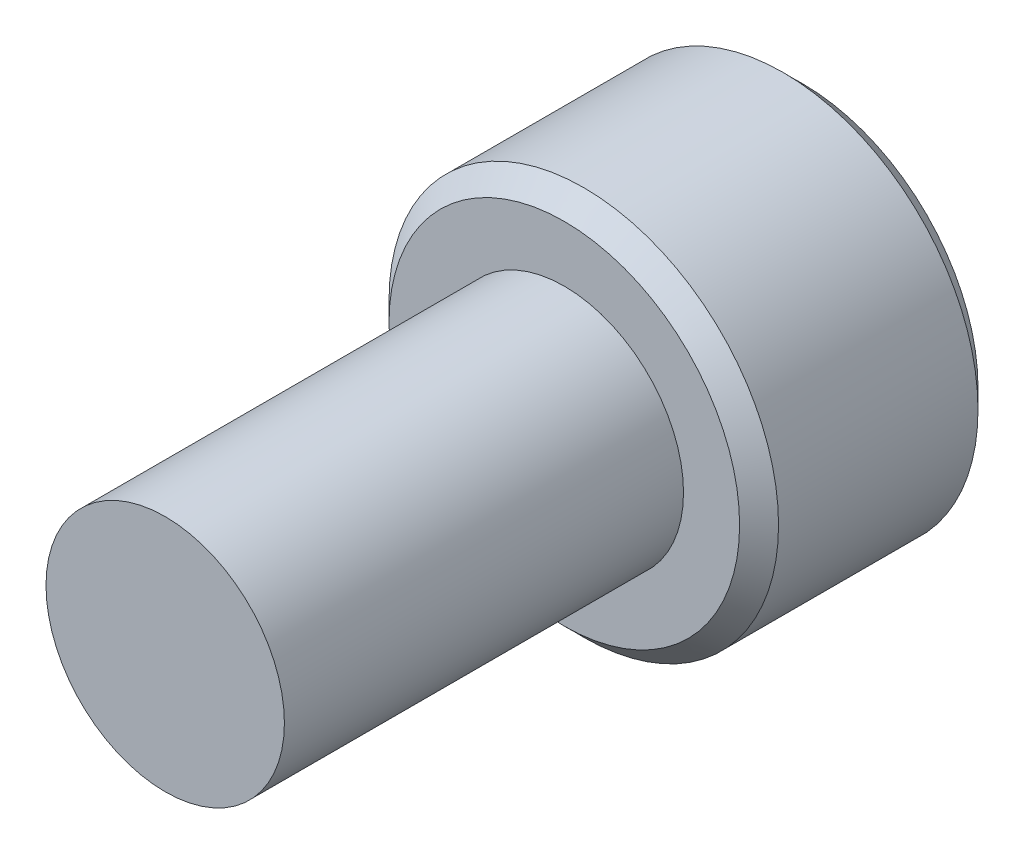
from build123d import *

# Parameters (mm, degrees)
SKETCH1_R          = 1.4224
EXTRUDE1_DEPTH     = 4.7625
SKETCH6_R          = 2.3241
EXTRUDE2_DEPTH     = 2.8448
CUT_EXTRUDE1_DEPTH = 1.7859375
CHAMFER1_SIZE      = 0.23241


with BuildPart() as part:
    # Sketch1 → Extrude1 (new body)
    with BuildSketch(Plane.XY):
        Circle(SKETCH1_R)
    extrude(amount=-EXTRUDE1_DEPTH)

    # Sketch6 → Extrude2 (add)
    with BuildSketch(Plane(origin=(0, 0, -4.7625), x_dir=(-1, 0, 0), z_dir=(0, 0, -1))):
        Circle(SKETCH6_R)
    extrude(amount=EXTRUDE2_DEPTH)

    # Sketch7 → Cut-Extrude1 (cut)
    with BuildSketch(Plane(origin=(0, 0, -7.6073), x_dir=(-1, 0, 0), z_dir=(0, 0, -1))):
        Polygon((0, 1.374815329), (-1.190625, 0.687407664), (-1.190625, -0.687407664), (0, -1.374815329), (1.190625, -0.687407664), (1.190625, 0.687407664), align=None)
    extrude(amount=-CUT_EXTRUDE1_DEPTH, mode=Mode.SUBTRACT)

    # Cut-Extrude2 cone 1 section (through the dimple's axis) → Cut-Extrude2 (revolve, cut)
    with BuildSketch(Plane(origin=(0, 0, -7.6073), x_dir=(0, 1, 0), z_dir=(1, 0, 0))):
        Polygon((0, 0), (1.374815329, 0), (0, 1.374815329), align=None)
    revolve(axis=Axis((0, 0, -7.6073), (0, 0, 1)), mode=Mode.SUBTRACT)

    # Chamfer1
    chamfer1_edges = [part.edges().sort_by_distance(p)[0] for p in [
        (2.3241, 0, -4.7625),
        (2.3241, 0, -7.6073),
    ]]
    chamfer(chamfer1_edges, length=CHAMFER1_SIZE)


solid = part.part
